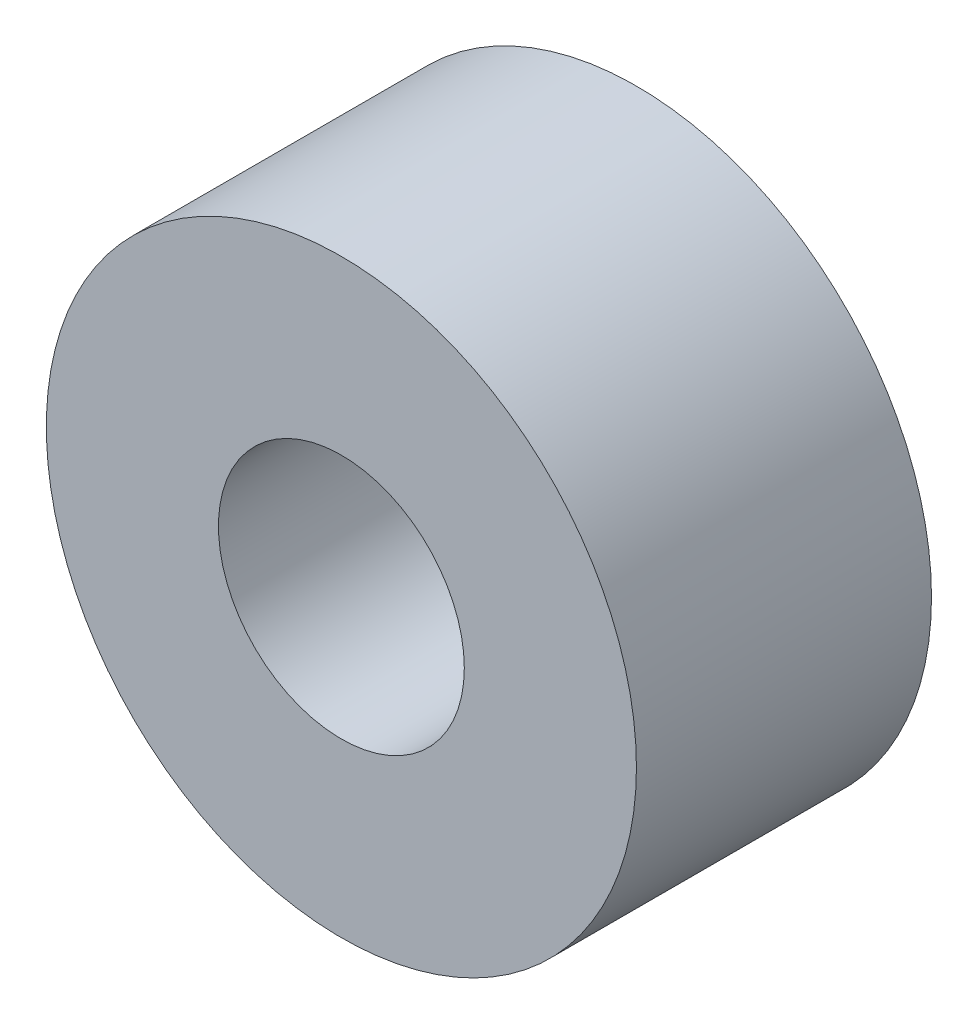
from build123d import *

# Parameters (mm, degrees)
SKETCH1_R           = 18
SKETCH1_R_2         = 7.5
BOSS_EXTRUDE1_DEPTH = 18


with BuildPart() as part:
    # Sketch1 → Boss-Extrude1 (new body)
    with BuildSketch(Plane.XY):
        Circle(SKETCH1_R)
        Circle(SKETCH1_R_2, mode=Mode.SUBTRACT)
    extrude(amount=BOSS_EXTRUDE1_DEPTH)


solid = part.part
